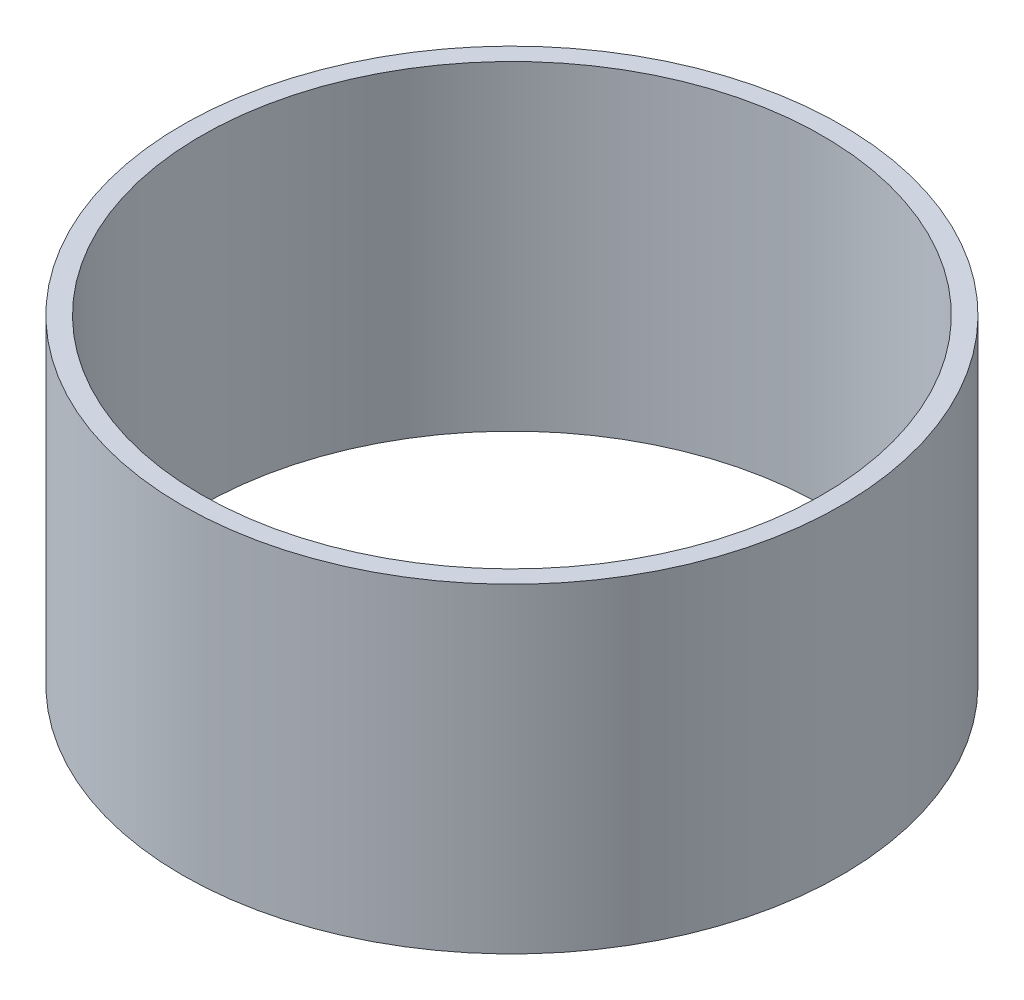
from build123d import *

# Parameters (mm, degrees)
SKETCH1_R           = 17.5
SKETCH1_R_2         = 16.5
BOSS_EXTRUDE1_DEPTH = 17


with BuildPart() as part:
    # Sketch1 → Boss-Extrude1 (new body)
    with BuildSketch(Plane(origin=(0, 0, 0), x_dir=(1, 0, 0), z_dir=(0, 1, 0))):
        with Locations(Location((0, 0, 0), (0, 0, 270))):
            Circle(SKETCH1_R)
        with Locations(Location((0, 0, 0), (0, 0, 270))):
            Circle(SKETCH1_R_2, mode=Mode.SUBTRACT)
    extrude(amount=BOSS_EXTRUDE1_DEPTH)


solid = part.part
